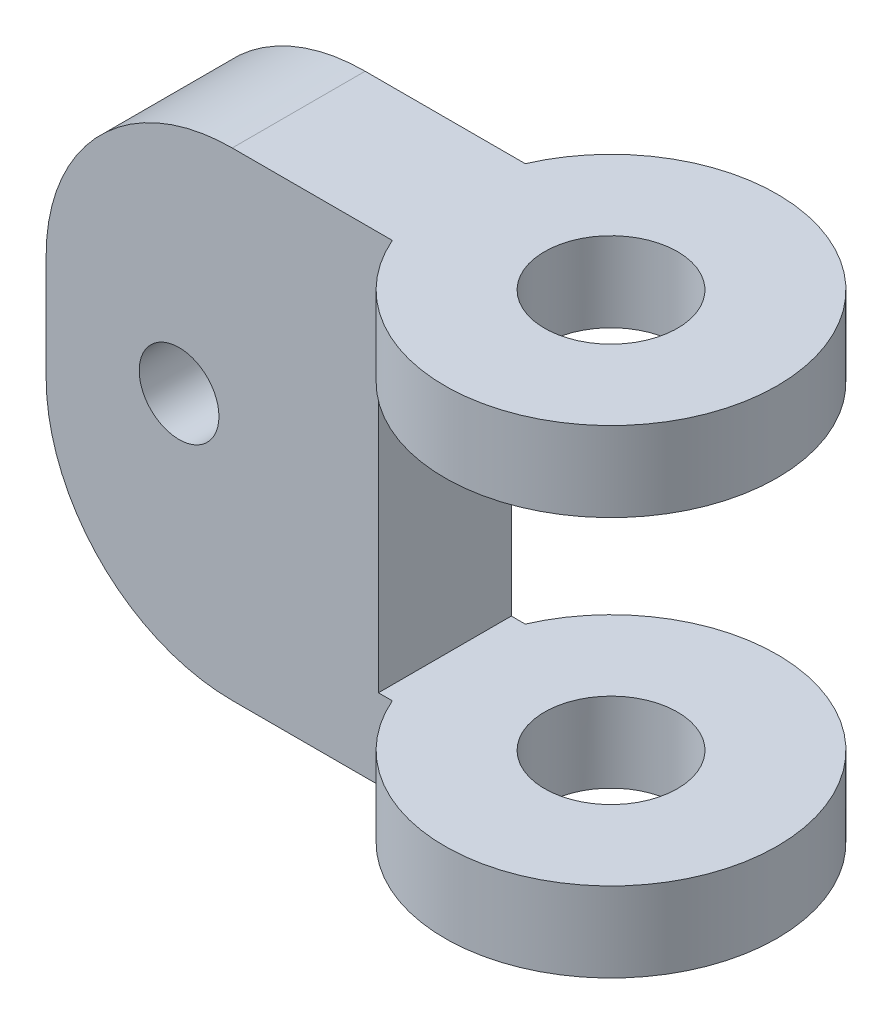
from build123d import *
from build123d.topology import SkipClean

# Parameters (mm, degrees)
CROQUIS1_R              = 1.5
SALIENTE_EXTRUIR1_DEPTH = 15
CROQUIS2_R              = 2.5
CORTAR_EXTRUIR1_DEPTH   = 20
CORTAR_EXTRUIR2_DEPTH   = 22


with BuildPart() as part:
    # Croquis1 → Saliente-Extruir1 (new body)
    with BuildSketch(Plane.XY):
        with BuildLine():
            Line((11.25, 14.1), (11.25, 11.1))
            Line((11.25, 11.1), (11.25, 5.1))
            Line((11.25, 5.1), (11.25, 2.1))
            Line((11.25, 2.1), (23.75, 2.1))
            Line((23.75, 2.1), (23.75, -0.9))
            Line((23.75, -0.9), (11.25, -0.9))
            Line((11.25, -0.9), (5.75, -0.9))
            ThreePointArc((5.75, -0.9), (0.800252532, 1.150252532), (-1.25, 6.1))
            Line((-1.25, 6.1), (-1.25, 10.1))
            ThreePointArc((-1.25, 10.1), (0.800252532, 15.049747468), (5.75, 17.1))
            Line((5.75, 17.1), (11.25, 17.1))
            Line((11.25, 17.1), (23.75, 17.1))
            Line((23.75, 17.1), (23.75, 14.1))
            Line((23.75, 14.1), (11.25, 14.1))
        make_face()
        with Locations((3.75, 8.1)):
            Circle(CROQUIS1_R, mode=Mode.SUBTRACT)
    extrude(amount=SALIENTE_EXTRUIR1_DEPTH)

    # Croquis2 → Cortar-Extruir1 (cut, symmetric)
    with BuildSketch(Plane(origin=(0, 0, 0), x_dir=(1, 0, 0), z_dir=(0, 1, 0))):
        with Locations(Location((17.5, -7.5, 0), (0, 0, 90))):
            Circle(CROQUIS2_R)
        with BuildLine():
            Line((17.5, -1.25), (11.25, 0))
            Line((11.25, 0), (11.126279301, 1.868603497))
            Line((11.126279301, 1.868603497), (29.663453957, 1.868603497))
            Line((29.663453957, 1.868603497), (29.663453957, -17.961269996))
            Line((29.663453957, -17.961269996), (11.25, -17.961269996))
            Line((11.25, -17.961269996), (11.25, -15))
            Line((11.25, -15), (17.5, -13.75))
            ThreePointArc((17.5, -13.75), (23.75, -7.5), (17.5, -1.25))
        make_face()
    extrude(amount=CORTAR_EXTRUIR1_DEPTH, both=True, mode=Mode.SUBTRACT)

    # Croquis3 → Cortar-Extruir2 (cut)
    with SkipClean():  # the faces are left unmerged after this step: merging them gives an invalid solid
        with BuildSketch(Plane(origin=(0, 17.1, 0), x_dir=(1, 0, 0), z_dir=(0, 1, 0))):
            Polygon((5.75, -10), (-2.050741432, -10), (-2.325121179, -18.2596058), (20.840368904, -18.2596058), (17.5, -13.75), (11.25, -15), (5.75, -15), align=None)
            with BuildLine():
                Line((11.771780381, -10), (5.75, -10))
                Line((5.75, -10), (5.75, -15))
                Line((5.75, -15), (11.25, -15))
                Line((11.25, -15), (17.5, -13.75))
                ThreePointArc((17.5, -13.75), (14.076734016, -12.729125166), (11.771780381, -10))
            make_face()
            with BuildLine():
                Line((5.75, 0), (5.75, -5))
                Line((5.75, -5), (11.771780381, -5))
                ThreePointArc((11.771780381, -5), (14.076734016, -2.270874834), (17.5, -1.25))
                Line((17.5, -1.25), (11.25, 0))
                Line((11.25, 0), (5.75, 0))
            make_face()
            Polygon((-2.050741432, -5), (5.75, -5), (5.75, 0), (11.25, 0), (17.5, -1.25), (17.5, 1.613327317), (-2.050741432, 1.613327317), align=None)
        extrude(amount=-CORTAR_EXTRUIR2_DEPTH, mode=Mode.SUBTRACT)


solid = part.part
